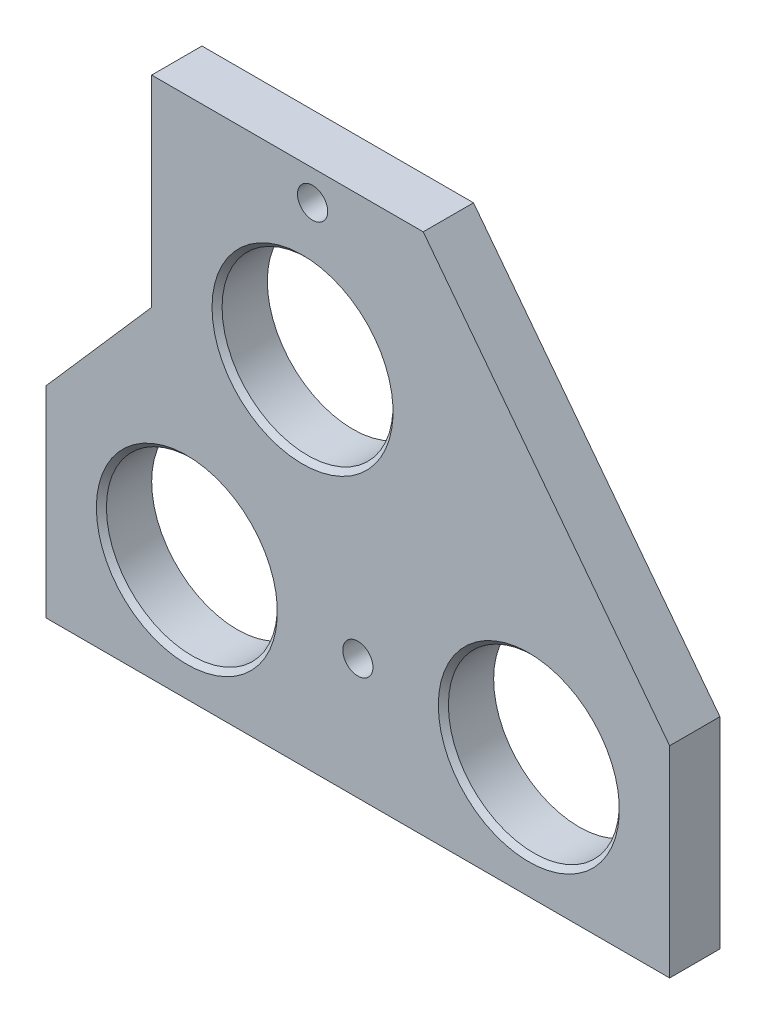
from build123d import *

# Parameters (mm, degrees)
SZKIC1_R                    = 8.5
SZKIC1_R_2                  = 1.5
DODANIE_WYCI_GNI_CIE1_DEPTH = 5
SFAZOWANIE2_SIZE            = 0.5


with BuildPart() as part:
    # Szkic1 → Dodanie-wyciągnięcie1 (new body)
    with BuildSketch(Plane.XY):
        Polygon((-14, -12), (-14, 8), (-3.5, 20), (-3.5, 40), (23.5, 40), (48, 8), (48, -12), align=None)
        Circle(SZKIC1_R, mode=Mode.SUBTRACT)
        with Locations((34, 0)):
            Circle(SZKIC1_R, mode=Mode.SUBTRACT)
        with Locations((11.5, 23)):
            Circle(SZKIC1_R, mode=Mode.SUBTRACT)
        with Locations((12.5, 37)):
            Circle(SZKIC1_R_2, mode=Mode.SUBTRACT)
        with Locations((17, 0)):
            Circle(SZKIC1_R_2, mode=Mode.SUBTRACT)
    extrude(amount=DODANIE_WYCI_GNI_CIE1_DEPTH)

    # Sfazowanie2
    sfazowanie2_edges = [part.edges().sort_by_distance(p)[0] for p in [
        (-8.5, 0, 5),
        (25.5, 0, 5),
        (3, 23, 5),
    ]]
    chamfer(sfazowanie2_edges, length=SFAZOWANIE2_SIZE)


solid = part.part
